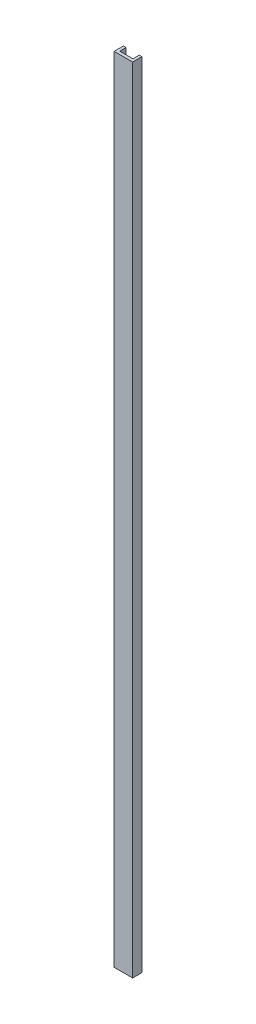
from build123d import *

# Parameters (mm, degrees)
EXTRUDE_1_DEPTH = 1200


with BuildPart() as part:
    # 草图1 → 凸台-拉伸1 (new body)
    with BuildSketch(Plane(origin=(0, 0, 0), x_dir=(1, 0, 0), z_dir=(0, 1, 0))):
        Polygon((-10, 7), (-10, -2.5), (10, -2.5), (10, 7), (14, 7), (14, -7), (-14, -7), (-14, 7), align=None)
    extrude(amount=EXTRUDE_1_DEPTH)


solid = part.part
